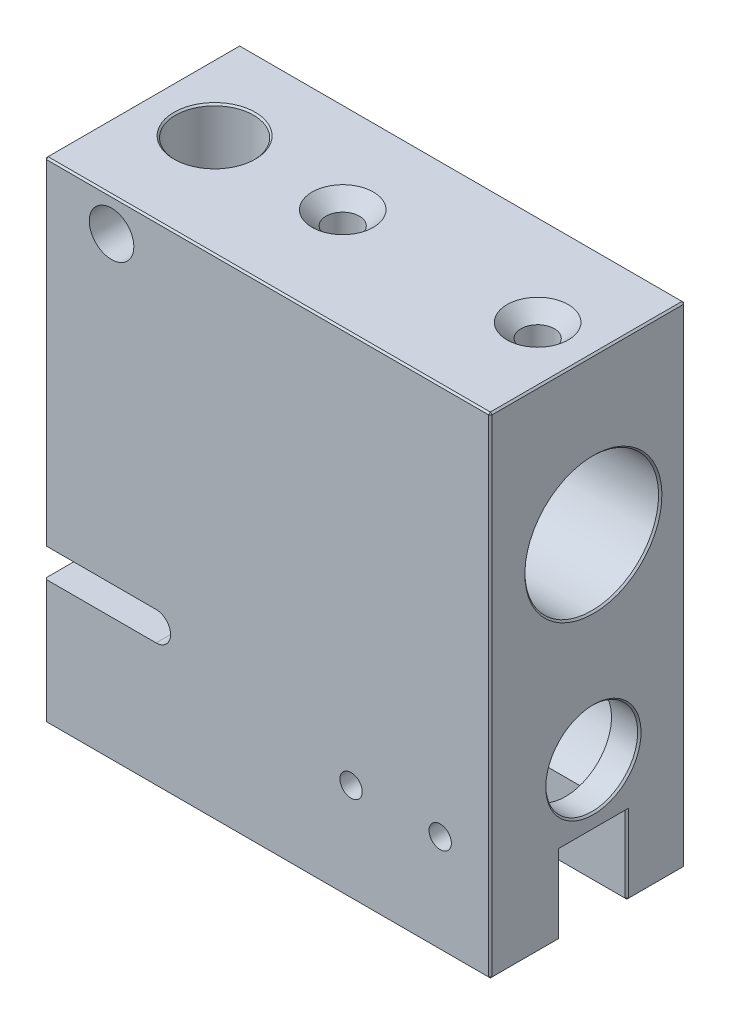
from build123d import *

# Parameters (mm, degrees)
ESQUISSE1_W                   = 80
ESQUISSE1_H                   = 88
BASE_EXTRUSION_DEPTH          = 35
ESQUISSE4_R                   = 12
BOSS_EXTRU_2_DEPTH            = 80
ESQUISSE5_R                   = 12
ENL_V_MAT_EXTRU_1_DEPTH       = 145
ESQUISSE6_W                   = 12
ESQUISSE6_H                   = 14
ENL_V_MAT_EXTRU_2_DEPTH       = 145
ESQUISSE12_R                  = 12.75
ENL_V_MAT_EXTRU_4_DEPTH       = 75
ESQUISSE13_R                  = 8.25
ENL_V_MAT_EXTRU_5_DEPTH       = 94.733665244
ESQUISSE17_W                  = 20
ESQUISSE17_H                  = 5.2
ENL_V_MAT_EXTRU_9_DEPTH       = 10
ESQUISSE18_R                  = 2.6
ENL_V_MAT_EXTRU_10_DEPTH      = 10
ESQUISSE20_R                  = 2.25
ENL_V_MAT_EXTRU_12_DEPTH      = 14
ESQUISSE21_R                  = 3
ENL_V_MAT_EXTRU_13_DEPTH      = 10
CHANFREIN9_SIZE               = 1.154700538
CHANFREIN9_SIZE2              = 2
CHANFREIN20_SIZE              = 1.154700538
CHANFREIN20_SIZE2             = 2
ESQUISSE22_R                  = 2
ENL_V_MAT_EXTRU_15_DEPTH      = 5.5
ESQUISSE24_R                  = 7
ENL_V_MAT_EXTRU_23_DEPTH      = 25
ENL_V_MAT_EXTRU_24_REACH      = 71
ENL_V_MAT_EXTRU_24_END_RADIUS = 7
ESQUISSE25_R                  = 4
ESQUISSE26_R                  = 2.5
ENL_V_MAT_EXTRU_25_DEPTH      = 15
ESQUISSE28_R                  = 3
ENL_V_MAT_EXTRU_26_DEPTH      = 12
CHANFREIN27_SIZE              = 2.5
CHANFREIN29_SIZE              = 0.3


with BuildPart() as part:
    # Esquisse1 → Base-Extrusion (new body)
    with BuildSketch(Plane.XY):
        Rectangle(ESQUISSE1_W, ESQUISSE1_H)
    extrude(amount=BASE_EXTRUSION_DEPTH)

    # Esquisse4 → Boss.-Extru.2 (add, through all)
    with BuildSketch(Plane.ZY.offset(40)):
        with Locations((16.5, 16)):
            Circle(ESQUISSE4_R)
    extrude(amount=-BOSS_EXTRU_2_DEPTH)

    # Esquisse5 → Enlèv. mat.-Extru.1 (cut)
    with BuildSketch(Plane.ZY.offset(40)):
        with Locations((16.5, 16)):
            Circle(ESQUISSE5_R)
    extrude(amount=-ENL_V_MAT_EXTRU_1_DEPTH, mode=Mode.SUBTRACT)

    # Esquisse6 → Enlèv. mat.-Extru.2 (cut)
    with BuildSketch(Plane(origin=(40, 0, 0), x_dir=(0, 0, -1), z_dir=(1, 0, 0))):
        with Locations((-16.5, -37)):
            Rectangle(ESQUISSE6_W, ESQUISSE6_H)
    extrude(amount=-ENL_V_MAT_EXTRU_2_DEPTH, mode=Mode.SUBTRACT)

    # Esquisse12 → Enlèv. mat.-Extru.4 (cut)
    with BuildSketch(Plane.ZY.offset(40)):
        with Locations((16.5, -19)):
            Circle(ESQUISSE12_R)
    extrude(amount=-ENL_V_MAT_EXTRU_4_DEPTH, mode=Mode.SUBTRACT)

    # Esquisse13 → Enlèv. mat.-Extru.5 (cut, through all)
    with BuildSketch(Plane.ZY.offset(-35)):
        with Locations((16.5, -19)):
            Circle(ESQUISSE13_R)
    extrude(amount=-ENL_V_MAT_EXTRU_5_DEPTH, mode=Mode.SUBTRACT)

    # Esquisse17 → Enlèv. mat.-Extru.9 (cut)
    with BuildSketch(Plane.XY.offset(35)):
        with Locations((-30, -19)):
            Rectangle(ESQUISSE17_W, ESQUISSE17_H)
    extrude(amount=-ENL_V_MAT_EXTRU_9_DEPTH, mode=Mode.SUBTRACT)

    # Esquisse18 → Enlèv. mat.-Extru.10 (cut)
    with BuildSketch(Plane.XY.offset(35)):
        with Locations((-20, -19)):
            Circle(ESQUISSE18_R)
    extrude(amount=-ENL_V_MAT_EXTRU_10_DEPTH, mode=Mode.SUBTRACT)

    # Esquisse20 → Enlèv. mat.-Extru.12 (cut)
    with BuildSketch(Plane.XZ.offset(44)):
        with Locations(Location((-10, 29.5, 0), (0, 0, 270))):
            Circle(ESQUISSE20_R)
        with Locations(Location((-10, 3.5, 0), (0, 0, 90))):
            Circle(ESQUISSE20_R)
    extrude(amount=-ENL_V_MAT_EXTRU_12_DEPTH, mode=Mode.SUBTRACT)

    # Esquisse21 → Enlèv. mat.-Extru.13 (cut)
    with BuildSketch(Plane.XZ.offset(44)):
        with Locations(Location((-10, 3.5, 0), (0, 0, 270))):
            Circle(ESQUISSE21_R)
        with Locations(Location((-10, 29.5, 0), (0, 0, 90))):
            Circle(ESQUISSE21_R)
    extrude(amount=-ENL_V_MAT_EXTRU_13_DEPTH, mode=Mode.SUBTRACT)

    # Chanfrein9
    chanfrein9_edges = [part.edges().sort_by_distance(p)[0] for p in [
        (-10, -30, 1.25),
    ]]
    chanfrein9_side = [part.faces().sort_by_distance(p)[0] for p in [
        (-10, -32, 1.25),
    ]]
    chamfer(chanfrein9_edges, length=CHANFREIN9_SIZE, length2=CHANFREIN9_SIZE2, reference=chanfrein9_side[0])

    # Chanfrein20
    chanfrein20_edges = [part.edges().sort_by_distance(p)[0] for p in [
        (-10, -30, 31.75),
    ]]
    chanfrein20_side = [part.faces().sort_by_distance(p)[0] for p in [
        (-10, -32, 31.75),
    ]]
    chamfer(chanfrein20_edges, length=CHANFREIN20_SIZE, length2=CHANFREIN20_SIZE2, reference=chanfrein20_side[0])

    # Esquisse22 → Enlèv. mat.-Extru.15 (cut)
    with BuildSketch(Plane.XY.offset(35)):
        with Locations((31, -26.25)):
            Circle(ESQUISSE22_R)
        with Locations((15, -26.25)):
            Circle(ESQUISSE22_R)
    extrude(amount=-ENL_V_MAT_EXTRU_15_DEPTH, mode=Mode.SUBTRACT)

    # Esquisse24 → Enlèv. mat.-Extru.23 (cut)
    with BuildSketch(Plane(origin=(0, 44, 0), x_dir=(-1, 0, 0), z_dir=(0, 1, 0))):
        with Locations((28, 16.5)):
            Circle(ESQUISSE24_R)
    extrude(amount=-ENL_V_MAT_EXTRU_23_DEPTH, mode=Mode.SUBTRACT)

    # Enlèv. mat.-Extru.24: up to this cylinder (the profile starts outside it)
    enl_v_mat_extru_24_end = Plane(origin=(-28, 38, 16.5), z_dir=(0, 1, 0)) * Cylinder(ENL_V_MAT_EXTRU_24_END_RADIUS, 157, mode=Mode.PRIVATE)
    # Esquisse25 → Enlèv. mat.-Extru.24 (cut, up to the surface)
    with BuildSketch(Plane.XY.offset(35), mode=Mode.PRIVATE) as enl_v_mat_extru_24_sk1:
        with Locations((-28, 38)):
            Circle(ESQUISSE25_R)
    enl_v_mat_extru_24_tool1 = extrude(enl_v_mat_extru_24_sk1.sketch, amount=-ENL_V_MAT_EXTRU_24_REACH, mode=Mode.PRIVATE) - enl_v_mat_extru_24_end
    add(enl_v_mat_extru_24_tool1.solids().sort_by_distance((-28, 38, 35))[0], mode=Mode.SUBTRACT)

    # Esquisse26 → Enlèv. mat.-Extru.25 (cut)
    with BuildSketch(Plane(origin=(0, 44, 0), x_dir=(-1, 0, 0), z_dir=(0, 1, 0))):
        with Locations((-30, 16.5)):
            Circle(ESQUISSE26_R)
        with Locations((5, 16.5)):
            Circle(ESQUISSE26_R)
    extrude(amount=-ENL_V_MAT_EXTRU_25_DEPTH, mode=Mode.SUBTRACT)

    # Esquisse28 → Enlèv. mat.-Extru.26 (cut)
    with BuildSketch(Plane(origin=(0, 44, 0), x_dir=(-1, 0, 0), z_dir=(0, 1, 0))):
        with Locations((-30, 16.5)):
            Circle(ESQUISSE28_R)
        with Locations((5, 16.5)):
            Circle(ESQUISSE28_R)
    extrude(amount=-ENL_V_MAT_EXTRU_26_DEPTH, mode=Mode.SUBTRACT)

    # Chanfrein27
    chanfrein27_edges = [part.edges().sort_by_distance(p)[0] for p in [
        (33, 44, 16.5),
        (-2, 44, 16.5),
    ]]
    chamfer(chanfrein27_edges, length=CHANFREIN27_SIZE)

    # Chanfrein29
    chanfrein29_edges = [part.edges().sort_by_distance(p)[0] for p in [
        (40, 0, 35),
        (-21, 44, 16.5),
        (0, 44, 35),
        (40, 16, 4.5),
        (-40, 16, 4.5),
        (40, -44, 5.25),
        (-40, -44, 5.25),
        (0, -44, 10.5),
        (0, -44, 22.5),
        (40, -37, 22.5),
        (40, -30, 16.5),
        (40, -37, 10.5),
        (-40, -37.125, 22.5),
        (-40, 13.8, 35),
        (-40, -37.125, 10.5),
        (0, 44, 0),
        (-40, -26.64591319, 26.703063829),
        (40, 0, 0),
        (0, -44, 0),
        (40, -19, 8.25),
        (-40, 0, 0),
        (-40, -8.796936171, 8.85408681),
        (-40, -32.8, 35),
        (-40, -16.4, 31.991043583),
        (0, -44, 35),
        (-40, 44, 17.5),
        (40, 44, 17.5),
        (40, -44, 28.75),
        (-40, -44, 28.75),
    ]]
    chamfer(chanfrein29_edges, length=CHANFREIN29_SIZE)


solid = part.part
